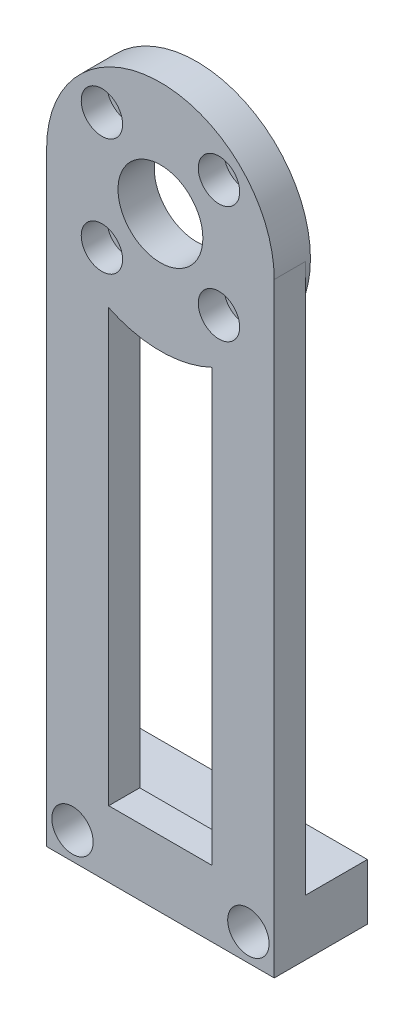
from build123d import *

# Parameters (mm, degrees)
BOSS_EXTRUDE1_DEPTH = 3
BOSS_EXTRUDE2_START = -0.5
SKETCH1_3_R         = 11
BOSS_EXTRUDE2_DEPTH = 0.5
SKETCH2_R           = 4.1
SKETCH2_R_2         = 1.1
CUT_EXTRUDE1_DEPTH  = 3.5
SKETCH2_3_R         = 2
CUT_EXTRUDE2_DEPTH  = 2.5
CIRPATTERN2_COUNT   = 4
SKETCH1_6_W         = 11
SKETCH1_6_H         = 5.42
BOSS_EXTRUDE3_DEPTH = 6
SKETCH3_R           = 1.1
CUT_EXTRUDE3_DEPTH  = 9
SKETCH3_3_R         = 2
SKETCH3_3_R_2       = 1.1
CUT_EXTRUDE4_DEPTH  = 8


with BuildPart() as part:
    # Sketch1 → Boss-Extrude1 (new body)
    with BuildSketch(Plane.XY):
        with BuildLine():
            Line((-11, 29.235), (-11, -29.235))
            Line((-11, -29.235), (11, -29.235))
            Line((11, -29.235), (11, 29.235))
            ThreePointArc((11, 29.235), (0, 40.235), (-11, 29.235))
        make_face()
        with BuildLine():
            Line((5, -22.815), (-5, -22.815))
            Line((-5, -22.815), (-5, 18.878842411))
            ThreePointArc((-5, 18.878842411), (0, 17.735), (5, 18.878842411))
            Line((5, 18.878842411), (5, -22.815))
        make_face(mode=Mode.SUBTRACT)
    extrude(amount=BOSS_EXTRUDE1_DEPTH)

    # Sketch1<3> → Boss-Extrude2 (add)
    with BuildSketch(Plane.XY.offset(BOSS_EXTRUDE2_START)):
        with Locations((0, 29.235)):
            Circle(SKETCH1_3_R)
    extrude(amount=BOSS_EXTRUDE2_DEPTH)

    # Sketch2 → Cut-Extrude1 (cut)
    with BuildSketch(Plane.XY.offset(3)):
        with Locations((0, 29.235)):
            Circle(SKETCH2_R)
        with Locations((5.656854249, 34.891854249)):
            Circle(SKETCH2_R_2)
    cut_extrude1 = extrude(amount=-CUT_EXTRUDE1_DEPTH, mode=Mode.SUBTRACT)

    # Sketch2<3> → Cut-Extrude2 (cut)
    with BuildSketch(Plane.XY.offset(3)):
        with Locations((5.656854249, 34.891854249)):
            Circle(SKETCH2_3_R)
    cut_extrude2 = extrude(amount=-CUT_EXTRUDE2_DEPTH, mode=Mode.SUBTRACT)

    # CirPattern2: Cut-Extrude1, Cut-Extrude2 ×4 about axis
    cirpattern2_axis = Axis((0, 29.235, 0), (0, 0, 1))
    add([cut_extrude1.rotate(cirpattern2_axis, i * 360 / CIRPATTERN2_COUNT) for i in range(1, CIRPATTERN2_COUNT)], mode=Mode.SUBTRACT)
    add([cut_extrude2.rotate(cirpattern2_axis, i * 360 / CIRPATTERN2_COUNT) for i in range(1, CIRPATTERN2_COUNT)], mode=Mode.SUBTRACT)

    # Sketch1<6> → Boss-Extrude3 (add)
    with BuildSketch(Plane.XY):
        with Locations((-5.5, -26.525)):
            Rectangle(SKETCH1_6_W, SKETCH1_6_H)
        with Locations((5.5, -26.525)):
            Rectangle(SKETCH1_6_W, SKETCH1_6_H)
    extrude(amount=-BOSS_EXTRUDE3_DEPTH)

    # Sketch3 → Cut-Extrude3 (cut)
    with BuildSketch(Plane.XY.offset(3)):
        with Locations((-8.5, -26.62018786)):
            Circle(SKETCH3_R)
        with Locations((8.5, -26.62018786)):
            Circle(SKETCH3_R)
    extrude(amount=-CUT_EXTRUDE3_DEPTH, mode=Mode.SUBTRACT)

    # Sketch3<3> → Cut-Extrude4 (cut)
    # profile 1 of 2: a face of its own
    with BuildSketch(Plane.XY.offset(3)):
        with Locations((-8.5, -26.62018786)):
            Circle(SKETCH3_3_R)
        with Locations((-8.5, -26.62018786)):
            Circle(SKETCH3_3_R_2, mode=Mode.SUBTRACT)
    # profile 2 of 2: a face of its own
    with BuildSketch(Plane.XY.offset(3)):
        with Locations((8.5, -26.62018786)):
            Circle(SKETCH3_3_R)
        with Locations((8.5, -26.62018786)):
            Circle(SKETCH3_3_R_2, mode=Mode.SUBTRACT)
    extrude(amount=-CUT_EXTRUDE4_DEPTH, mode=Mode.SUBTRACT)


solid = part.part
